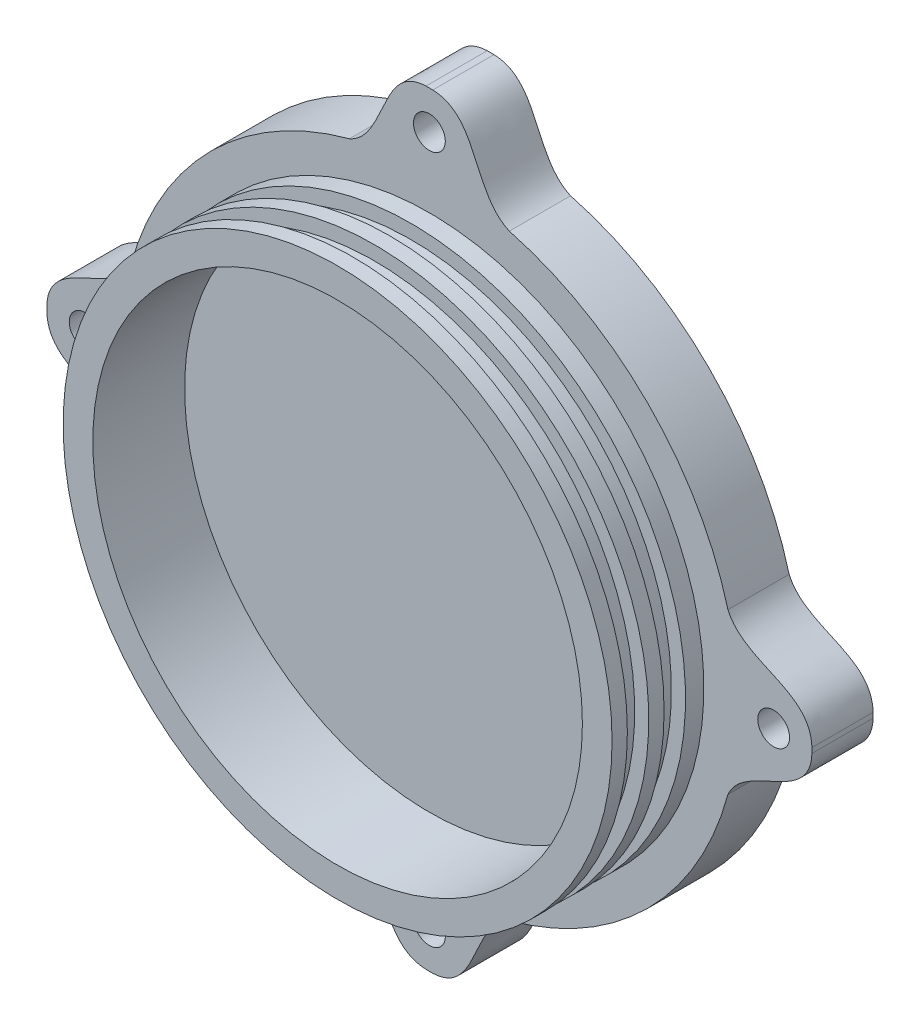
from build123d import *

# Parameters (mm, degrees)
SKETCH1_R           = 44.85
BOSS_EXTRUDE1_DEPTH = 15
SKETCH2_R           = 62.5
BOSS_EXTRUDE2_DEPTH = 10
SKETCH3_R           = 40
CUT_EXTRUDE1_DEPTH  = 15
SKETCH4_W           = 3.5
SKETCH4_H           = 3.5
SKETCH7_R           = 2.6
CUT_EXTRUDE4_DEPTH  = 92.855865354
CIRPATTERN1_COUNT   = 4
CUT_EXTRUDE6_DEPTH  = 10


with BuildPart() as part:
    # Sketch1 → Boss-Extrude1 (new body)
    with BuildSketch(Plane.XY):
        Circle(SKETCH1_R)
    extrude(amount=BOSS_EXTRUDE1_DEPTH)

    # Sketch2 → Boss-Extrude2 (add)
    with BuildSketch(Plane(origin=(0, 0, 0), x_dir=(-1, 0, 0), z_dir=(0, 0, -1))):
        Circle(SKETCH2_R)
    extrude(amount=BOSS_EXTRUDE2_DEPTH)

    # Sketch3 → Cut-Extrude1 (cut)
    with BuildSketch(Plane.XY.offset(15)):
        Circle(SKETCH3_R)
    extrude(amount=-CUT_EXTRUDE1_DEPTH, mode=Mode.SUBTRACT)

    # Sketch4 → Cut-Revolve1 (revolve, cut)
    with BuildSketch(Plane(origin=(0, 0, 0), x_dir=(0, 0, -1), z_dir=(1, 0, 0))):
        with Locations((-10.75, 44.3)):
            Rectangle(SKETCH4_W, SKETCH4_H)
        with Locations((-4.75, 44.3)):
            Rectangle(SKETCH4_W, SKETCH4_H)
    revolve(axis=Axis((0, 0, -42.713110189), (0, 0, 1)), mode=Mode.SUBTRACT)

    # Sketch7 → Cut-Extrude4 (cut, through all)
    with BuildSketch(Plane(origin=(0, 0, -10), x_dir=(-1, 0, 0), z_dir=(0, 0, -1))):
        with Locations((56.25, 0)):
            Circle(SKETCH7_R)
    cut_extrude4 = extrude(amount=-CUT_EXTRUDE4_DEPTH, mode=Mode.SUBTRACT)

    # CirPattern1: Cut-Extrude4 ×4 about axis
    cirpattern1_axis = Axis((0, 0, -45.874761596), (0, 0, 1))
    for i in range(1, CIRPATTERN1_COUNT):
        add(cut_extrude4.rotate(cirpattern1_axis, i * 360 / CIRPATTERN1_COUNT), mode=Mode.SUBTRACT)

    # Sketch9 → Cut-Extrude6 (cut)
    with BuildSketch(Plane.XY):
        with BuildLine():
            ThreePointArc((13.070361778, 48.779254228), (35.70889245, 35.70889245), (48.779254228, 13.070361778))
            add(Edge.make_bspline(
                [(62.498616294, 0.415886171), (62.283969661, 8.150798689), (51.453042115, 6.968928103), (48.779254228, 13.070361778)],
                knots=[0.017259954, 0.017259954, 0.017259954, 0.017259954, 1, 1, 1, 1], degree=3))
            ThreePointArc((62.498616294, 0.415886171), (44.24319492, 44.145098293), (0.55461157, 62.4975392))
            add(Edge.make_bspline(
                [(0.55461157, 62.4975392), (8.100511472, 62.208727423), (7.033582927, 51.397803822), (13.070361778, 48.779254228)],
                knots=[0.023286113, 0.023286113, 0.023286113, 0.023286113, 1, 1, 1, 1], degree=3))
        make_face()
        with BuildLine():
            add(Edge.make_bspline(
                [(62.498616294, -0.415886171), (62.283969661, -8.150798689), (51.453042115, -6.968928103), (48.779254228, -13.070361778)],
                knots=[0.017259954, 0.017259954, 0.017259954, 0.017259954, 1, 1, 1, 1], degree=3))
            ThreePointArc((48.779254228, -13.070361778), (35.70889245, -35.70889245), (13.070361778, -48.779254228))
            add(Edge.make_bspline(
                [(0.55461157, -62.4975392), (8.100511472, -62.208727423), (7.033582927, -51.397803822), (13.070361778, -48.779254228)],
                knots=[0.023286113, 0.023286113, 0.023286113, 0.023286113, 1, 1, 1, 1], degree=3))
            ThreePointArc((0.55461157, -62.4975392), (44.24319492, -44.145098293), (62.498616294, -0.415886171))
        make_face()
        with BuildLine():
            ThreePointArc((-48.779254228, 13.070361778), (-35.70889245, 35.70889245), (-13.070361778, 48.779254228))
            add(Edge.make_bspline(
                [(-0.55461157, 62.4975392), (-8.100511472, 62.208727423), (-7.033582927, 51.397803822), (-13.070361778, 48.779254228)],
                knots=[0.023286113, 0.023286113, 0.023286113, 0.023286113, 1, 1, 1, 1], degree=3))
            ThreePointArc((-0.55461157, 62.4975392), (-44.194173824, 44.194173824), (-62.4975392, 0.55461157))
            add(Edge.make_bspline(
                [(-62.4975392, 0.55461157), (-62.208727423, 8.100511472), (-51.397803822, 7.033582927), (-48.779254228, 13.070361778)],
                knots=[0.023286113, 0.023286113, 0.023286113, 0.023286113, 1, 1, 1, 1], degree=3))
        make_face()
        with BuildLine():
            add(Edge.make_bspline(
                [(-0.55461157, -62.4975392), (-8.100511472, -62.208727423), (-7.033582927, -51.397803822), (-13.070361778, -48.779254228)],
                knots=[0.023286113, 0.023286113, 0.023286113, 0.023286113, 1, 1, 1, 1], degree=3))
            ThreePointArc((-13.070361778, -48.779254228), (-35.70889245, -35.70889245), (-48.779254228, -13.070361778))
            add(Edge.make_bspline(
                [(-62.4975392, -0.55461157), (-62.208727423, -8.100511472), (-51.397803822, -7.033582927), (-48.779254228, -13.070361778)],
                knots=[0.023286113, 0.023286113, 0.023286113, 0.023286113, 1, 1, 1, 1], degree=3))
            ThreePointArc((-62.4975392, -0.55461157), (-44.194173824, -44.194173824), (-0.55461157, -62.4975392))
        make_face()
    extrude(amount=-CUT_EXTRUDE6_DEPTH, mode=Mode.SUBTRACT)


solid = part.part
